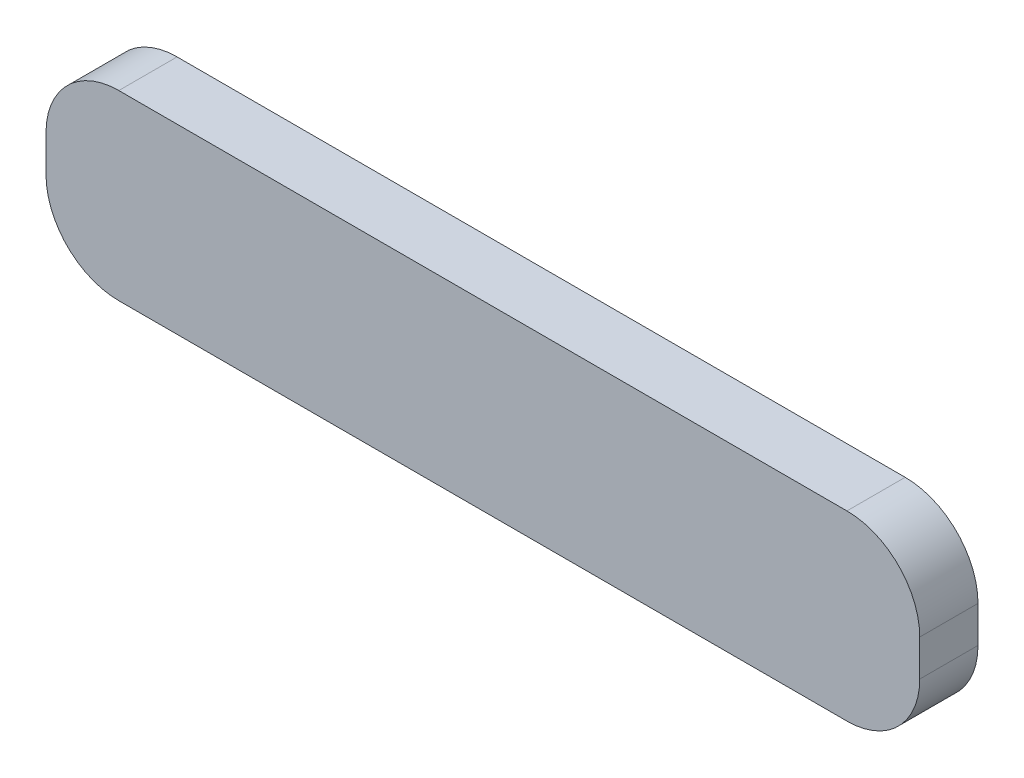
from build123d import *

# Parameters (mm, degrees)
SKETCH1_W           = 120
SKETCH1_H           = 25
BOSS_EXTRUDE1_DEPTH = 8
FILLET1_R           = 10


with BuildPart() as part:
    # Sketch1 → Boss-Extrude1 (new body)
    with BuildSketch(Plane.XY):
        with Locations((0.460829493, 4.366359447)):
            Rectangle(SKETCH1_W, SKETCH1_H)
    extrude(amount=BOSS_EXTRUDE1_DEPTH)

    # Fillet1
    fillet1_edges = [part.edges().sort_by_distance(p)[0] for p in [
        (-59.539170507, 16.866359447, 4),
        (60.460829493, 16.866359447, 4),
        (60.460829493, -8.133640553, 4),
        (-59.539170507, -8.133640553, 4),
    ]]
    fillet(fillet1_edges, radius=FILLET1_R)


solid = part.part
